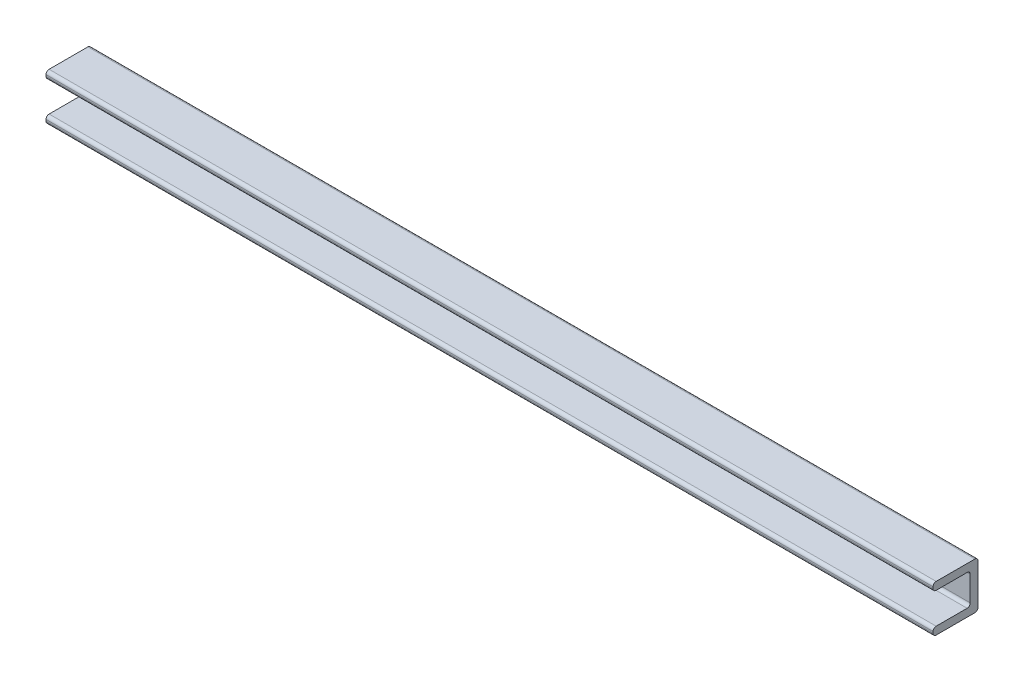
from build123d import *

# Parameters (mm, degrees)
BOSS_EXTRUDE1_START = 30
BOSS_EXTRUDE1_DEPTH = 572


with BuildPart() as part:
    # Sketch4 → Boss-Extrude1 (new body)
    with BuildSketch(Plane(origin=(0, 0, 0), x_dir=(0, 0, -1), z_dir=(1, 0, 0)).offset(BOSS_EXTRUDE1_START)):
        with BuildLine():
            Line((195, 13), (195, -13))
            ThreePointArc((195, -13), (194.414213562, -14.414213562), (193, -15))
            Line((193, -15), (168, -15))
            ThreePointArc((168, -15), (166.585786438, -14.414213562), (166, -13))
            Line((166, -13), (166, -12))
            ThreePointArc((166, -12), (166.585786438, -10.585786438), (168, -10))
            Line((168, -10), (188, -10))
            ThreePointArc((188, -10), (189.414213562, -9.414213562), (190, -8))
            Line((190, -8), (190, 8))
            ThreePointArc((190, 8), (189.414213562, 9.414213562), (188, 10))
            Line((188, 10), (168, 10))
            ThreePointArc((168, 10), (166.585786438, 10.585786438), (166, 12))
            Line((166, 12), (166, 13))
            ThreePointArc((166, 13), (166.585786438, 14.414213562), (168, 15))
            Line((168, 15), (193, 15))
            ThreePointArc((193, 15), (194.414213562, 14.414213562), (195, 13))
        make_face()
    extrude(amount=BOSS_EXTRUDE1_DEPTH)


solid = part.part
